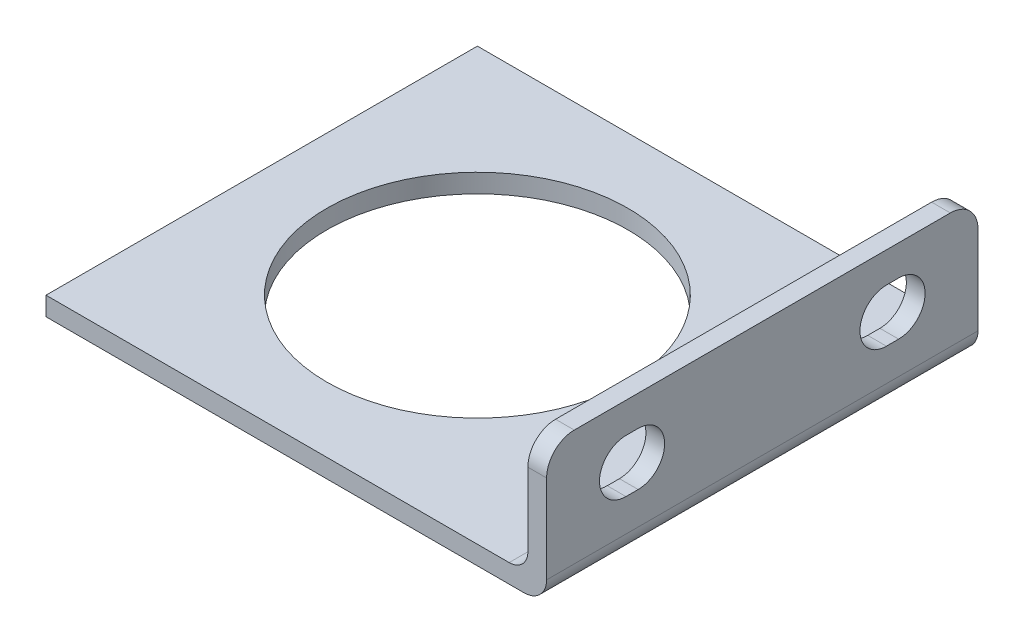
from build123d import *

# Parameters (mm, degrees)
EXTRUDE_1_DEPTH      = 26.5
EXTRUDE_1_DEPTH_BACK = 26.5
CUT_EXTRUDE_1_DEPTH  = 2.3
CUT_EXTRUDE_2_DEPTH  = 2.3
SKETCH_4_R           = 18.5
CUT_EXTRUDE_3_DEPTH  = 2.3
SKETCH_5_W           = 142.237580419
SKETCH_5_H           = 102.661015156
CUT_EXTRUDE_4_DEPTH  = 3.3


with BuildPart() as part:
    # 草图1 → 凸台-拉伸1 (new, two sides: drawn at the far end of the back side and taken through both)
    with BuildSketch(Plane.XY.offset(-EXTRUDE_1_DEPTH_BACK)):
        with BuildLine():
            Line((-26.5, 0), (32.24, 0))
            ThreePointArc((32.24, 0), (34.191614716, 0.808385284), (35, 2.76))
            Line((35, 2.76), (35, 17))
            Line((35, 17), (32.7, 17))
            Line((32.7, 17), (32.7, 4.6))
            ThreePointArc((32.7, 4.6), (32.026345597, 2.973654403), (30.4, 2.3))
            Line((30.4, 2.3), (-26.5, 2.3))
            Line((-26.5, 2.3), (-26.5, 0))
        make_face()
    extrude(amount=EXTRUDE_1_DEPTH + EXTRUDE_1_DEPTH_BACK)

    # 草图2 → 切除-拉伸1 (cut)
    with BuildSketch(Plane(origin=(35, 0, 0), x_dir=(0, 0, -1), z_dir=(1, 0, 0))):
        with BuildLine():
            Line((-16.75, 6.75), (-15.25, 6.75))
            ThreePointArc((-15.25, 6.75), (-12.951902961, 7.701902961), (-12, 10))
            ThreePointArc((-12, 10), (-12.951902961, 12.298097039), (-15.25, 13.25))
            Line((-15.25, 13.25), (-16.75, 13.25))
            ThreePointArc((-16.75, 13.25), (-19.048097039, 12.298097039), (-20, 10))
            ThreePointArc((-20, 10), (-19.048097039, 7.701902961), (-16.75, 6.75))
        make_face()
    extrude(amount=-CUT_EXTRUDE_1_DEPTH, mode=Mode.SUBTRACT)

    # 草图3 → 切除-拉伸2 (cut)
    with BuildSketch(Plane(origin=(35, 0, 0), x_dir=(0, 0, -1), z_dir=(1, 0, 0))):
        with BuildLine():
            Line((15.25, 6.75), (16.75, 6.75))
            ThreePointArc((16.75, 6.75), (19.048097039, 7.701902961), (20, 10))
            ThreePointArc((20, 10), (19.048097039, 12.298097039), (16.75, 13.25))
            Line((16.75, 13.25), (15.25, 13.25))
            ThreePointArc((15.25, 13.25), (12.951902961, 12.298097039), (12, 10))
            ThreePointArc((12, 10), (12.951902961, 7.701902961), (15.25, 6.75))
        make_face()
    extrude(amount=-CUT_EXTRUDE_2_DEPTH, mode=Mode.SUBTRACT)

    # 草图4 → 切除-拉伸3 (cut)
    with BuildSketch(Plane(origin=(0, 0, 0), x_dir=(1, 0, 0), z_dir=(0, 1, 0))):
        Circle(SKETCH_4_R)
    extrude(amount=CUT_EXTRUDE_3_DEPTH, mode=Mode.SUBTRACT)

    # 草图5 → 切除-拉伸4 (cut)
    with BuildSketch(Plane(origin=(35, 0, 0), x_dir=(0, 0, -1), z_dir=(1, 0, 0))):
        with Locations((4.017170159, 13.868386078)):
            Rectangle(SKETCH_5_W, SKETCH_5_H)
        with BuildLine():
            Line((-26.5, 0), (26.5, 0))
            Line((26.5, 0), (26.5, 13.6))
            ThreePointArc((26.5, 13.6), (25.504163056, 16.004163056), (23.1, 17))
            Line((23.1, 17), (-23.1, 17))
            ThreePointArc((-23.1, 17), (-25.504163056, 16.004163056), (-26.5, 13.6))
            Line((-26.5, 13.6), (-26.5, 0))
        make_face(mode=Mode.SUBTRACT)
    extrude(amount=-CUT_EXTRUDE_4_DEPTH, mode=Mode.SUBTRACT)


solid = part.part
